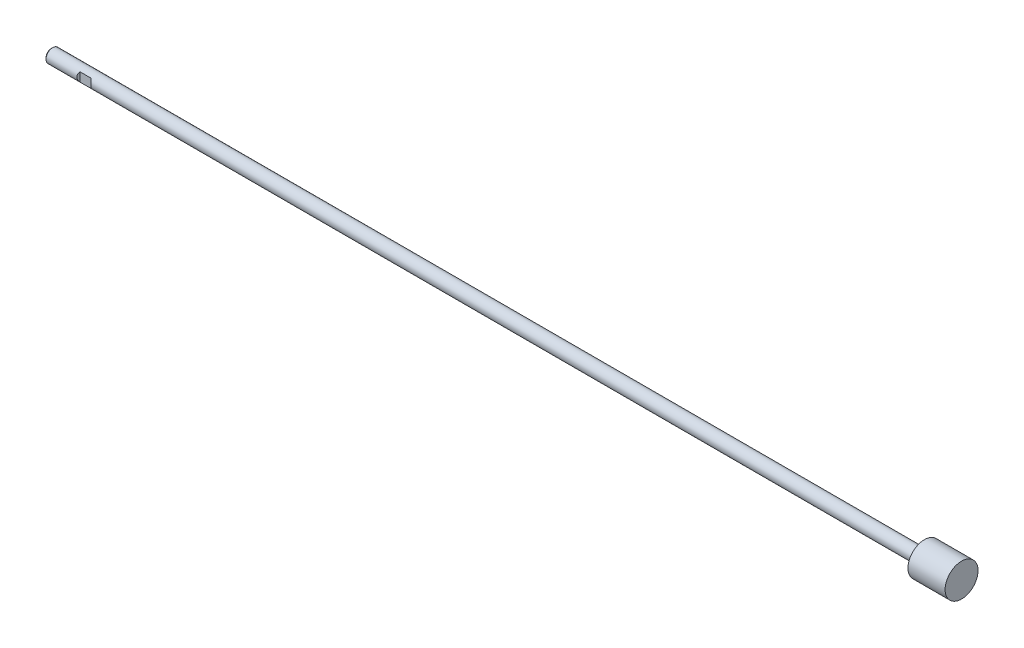
from build123d import *

# Parameters (mm, degrees)
CUT_EXTRUDE_1_DEPTH      = 3
CUT_EXTRUDE_1_DEPTH_BACK = 3


with BuildPart() as part:
    # 草图1 → 旋转1 (revolve)
    with BuildSketch(Plane.XY):
        Polygon((0, 0), (0, 3.233), (0.767, 4), (517, 4), (517, 9.75), (539, 9.75), (539, 0), align=None)
    revolve(axis=Axis((539, 0, 0), (-1, 0, 0)))

    # 草图2 → 切除-拉伸1 (cut, two sides: drawn at the far end of the back side and taken through both)
    with BuildSketch(Plane(origin=(0, 0, 0), x_dir=(1, 0, 0), z_dir=(0, 1, 0)).offset(-CUT_EXTRUDE_1_DEPTH_BACK)):
        Polygon((-5, -12), (35.4, -12), (26.4, -3), (20, -3), (18, -5), (18, -10), (-3, -10), (-3, 10), (18, 10), (18, 5), (20, 3), (26.4, 3), (35.4, 12), (-5, 12), align=None)
    extrude(amount=CUT_EXTRUDE_1_DEPTH + CUT_EXTRUDE_1_DEPTH_BACK, mode=Mode.SUBTRACT)


solid = part.part
